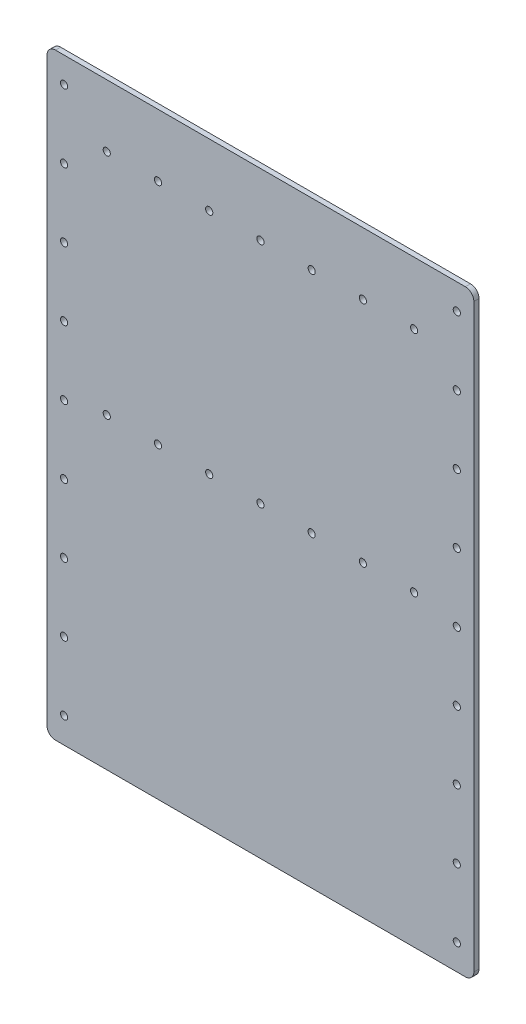
from build123d import *

# Parameters (mm, degrees)
SKETCH1_W           = 250
SKETCH1_H           = 350
BOSS_EXTRUDE1_DEPTH = 3
SKETCH3_R           = 2.1
CUT_EXTRUDE1_DEPTH  = 216.079055233
FILLET1_R           = 5
SKETCH4_R           = 2.1
CUT_EXTRUDE2_DEPTH  = 216.079055233
LPATTERN1_COUNT     = 2
LPATTERN1_PITCH     = 133.5


with BuildPart() as part:
    # Sketch1 → Boss-Extrude1 (new body)
    with BuildSketch(Plane.XY):
        Rectangle(SKETCH1_W, SKETCH1_H)
    extrude(amount=BOSS_EXTRUDE1_DEPTH)

    # Sketch3 → Cut-Extrude1 (cut, through all)
    with BuildSketch(Plane(origin=(0, 0, 0), x_dir=(-1, 0, 0), z_dir=(0, 0, -1))):
        with Locations((-115, 160)):
            Circle(SKETCH3_R)
        with Locations((-115, 120)):
            Circle(SKETCH3_R)
        with Locations((-115, 80)):
            Circle(SKETCH3_R)
        with Locations((-115, 40)):
            Circle(SKETCH3_R)
        with Locations((-115, 0)):
            Circle(SKETCH3_R)
        with Locations((-115, -40)):
            Circle(SKETCH3_R)
        with Locations((-115, -80)):
            Circle(SKETCH3_R)
        with Locations((-115, -120)):
            Circle(SKETCH3_R)
        with Locations((-115, -160)):
            Circle(SKETCH3_R)
    cut_extrude1 = extrude(amount=-CUT_EXTRUDE1_DEPTH, mode=Mode.SUBTRACT)

    # Mirror1: Cut-Extrude1 across plane
    add(cut_extrude1.mirror(Plane(origin=(0, 0, 0), x_dir=(0, 0, 1), z_dir=(1, 0, 0))), mode=Mode.SUBTRACT)

    # Fillet1
    fillet1_edges = [part.edges().sort_by_distance(p)[0] for p in [
        (125, -175, 1.5),
        (-125, -175, 1.5),
        (-125, 175, 1.5),
        (125, 175, 1.5),
    ]]
    fillet(fillet1_edges, radius=FILLET1_R)

    # Sketch4 → Cut-Extrude2 (cut, through all)
    with BuildSketch(Plane(origin=(0, 0, 0), x_dir=(-1, 0, 0), z_dir=(0, 0, -1))):
        with Locations((-90, 138.5)):
            Circle(SKETCH4_R)
        with Locations((-60, 138.5)):
            Circle(SKETCH4_R)
        with Locations((-30, 138.5)):
            Circle(SKETCH4_R)
        with Locations((0, 138.5)):
            Circle(SKETCH4_R)
        with Locations((30, 138.5)):
            Circle(SKETCH4_R)
        with Locations((60, 138.5)):
            Circle(SKETCH4_R)
        with Locations((90, 138.5)):
            Circle(SKETCH4_R)
    cut_extrude2 = extrude(amount=-CUT_EXTRUDE2_DEPTH, mode=Mode.SUBTRACT)

    # LPattern1: Cut-Extrude2 ×2
    with Locations(*[(0, -i * LPATTERN1_PITCH, 0) for i in range(1, LPATTERN1_COUNT)]):
        add(cut_extrude2, mode=Mode.SUBTRACT)


solid = part.part
